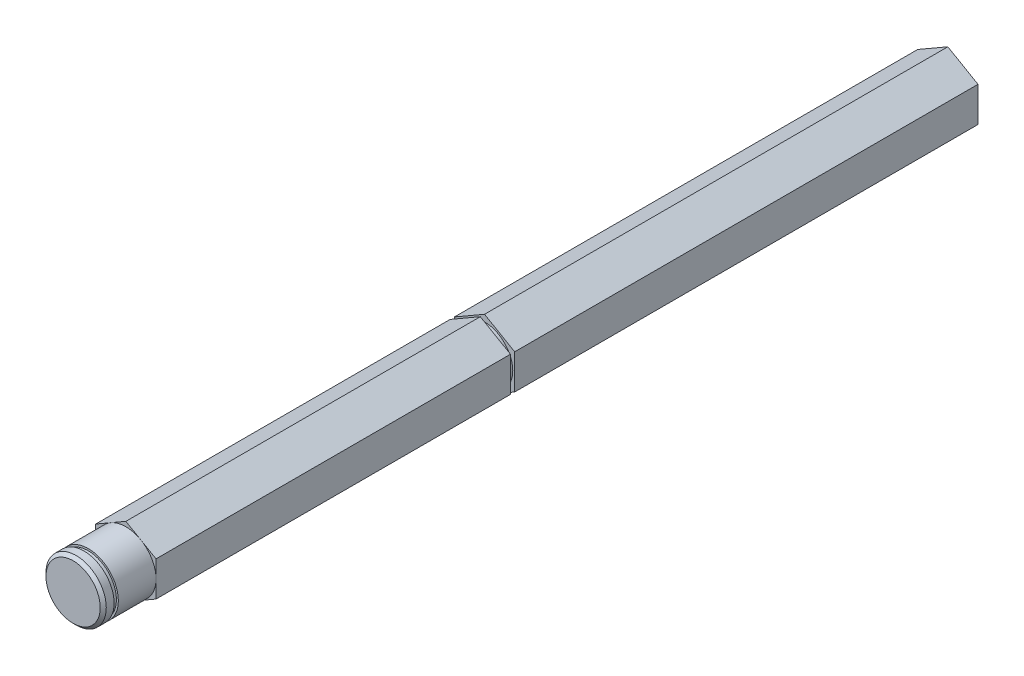
from build123d import *

# Parameters (mm, degrees)
BOSS_EXTRUDE1_DEPTH = 184.15
SKETCH2_R           = 7.332348419
SKETCH2_R_2         = 6.35
CUT_EXTRUDE1_DEPTH  = 11.1125
SKETCH3_W           = 0.889
SKETCH3_H           = 0.4064
SKETCH3_H_2         = 3.038077808
CHAMFER1_SIZE       = 0.635


with BuildPart() as part:
    # Sketch1 → Boss-Extrude1 (new body)
    with BuildSketch(Plane.XY):
        Polygon((0, 7.332348419), (-6.35, 3.666174209), (-6.35, -3.666174209), (0, -7.332348419), (6.35, -3.666174209), (6.35, 3.666174209), align=None)
    extrude(amount=BOSS_EXTRUDE1_DEPTH)

    # Sketch2 → Cut-Extrude1 (cut)
    with BuildSketch(Plane.XY.offset(184.15)):
        Circle(SKETCH2_R)
        Circle(SKETCH2_R_2, mode=Mode.SUBTRACT)
    extrude(amount=-CUT_EXTRUDE1_DEPTH, mode=Mode.SUBTRACT)

    # Sketch3 → Cut-Revolve1 (revolve, cut)
    with BuildSketch(Plane(origin=(0, 0, 0), x_dir=(0, 0, -1), z_dir=(1, 0, 0)), mode=Mode.PRIVATE) as cut_revolve1_sk:
        with Locations((-181.4195, 6.1468)):
            Rectangle(SKETCH3_W, SKETCH3_H)
        with Locations((-97.9805, 7.462638904)):
            Rectangle(SKETCH3_W, SKETCH3_H_2)
    revolve(cut_revolve1_sk.sketch.rotate(Axis((0, 0, 184.15), (0, 0, -1)), 90), axis=Axis((0, 0, 184.15), (0, 0, -1)), mode=Mode.SUBTRACT)

    # Chamfer1
    chamfer1_edges = [part.edges().sort_by_distance(p)[0] for p in [
        (-6.35, 0, 184.15),
    ]]
    chamfer(chamfer1_edges, length=CHAMFER1_SIZE)


solid = part.part
